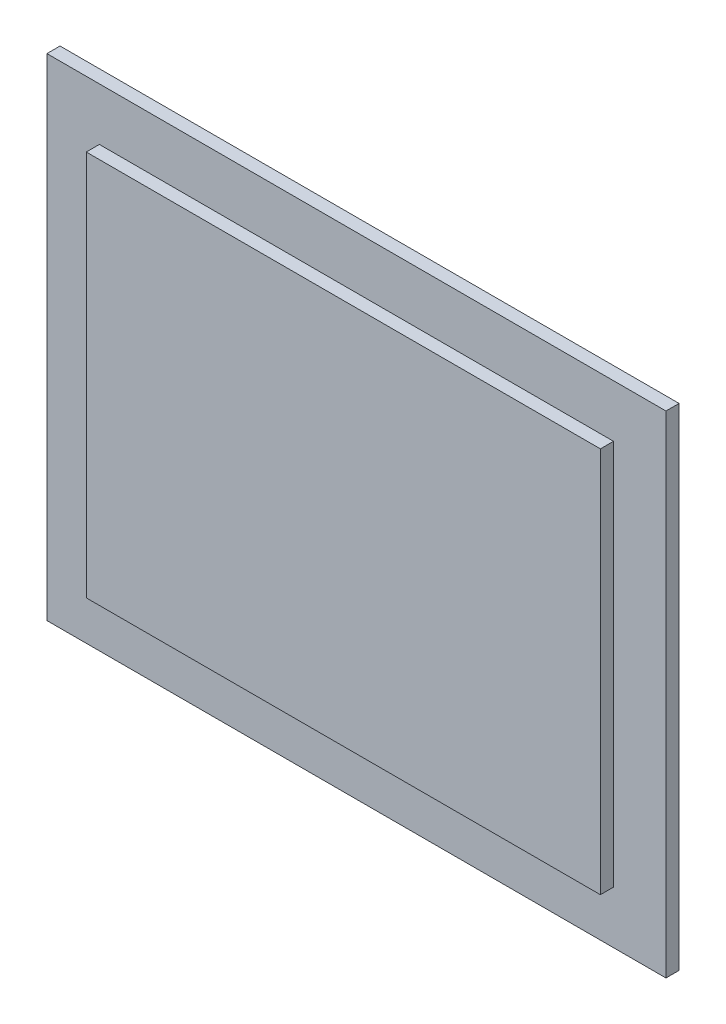
from build123d import *

# Parameters (mm, degrees)
SKETCH1_W      = 74.93
SKETCH1_H      = 59.436
EXTRUDE1_DEPTH = 1.5875
SKETCH2_W      = 62.23
SKETCH2_H      = 46.736
EXTRUDE2_DEPTH = 1.5875


with BuildPart() as part:
    # Sketch1 → Extrude1 (new body)
    with BuildSketch(Plane.XY):
        with Locations((37.465, 29.718)):
            Rectangle(SKETCH1_W, SKETCH1_H)
    extrude(amount=-EXTRUDE1_DEPTH)

    # Sketch2 → Extrude2 (add)
    with BuildSketch(Plane.XY):
        with Locations((37.465, 29.718)):
            Rectangle(SKETCH2_W, SKETCH2_H)
    extrude(amount=EXTRUDE2_DEPTH)


solid = part.part
